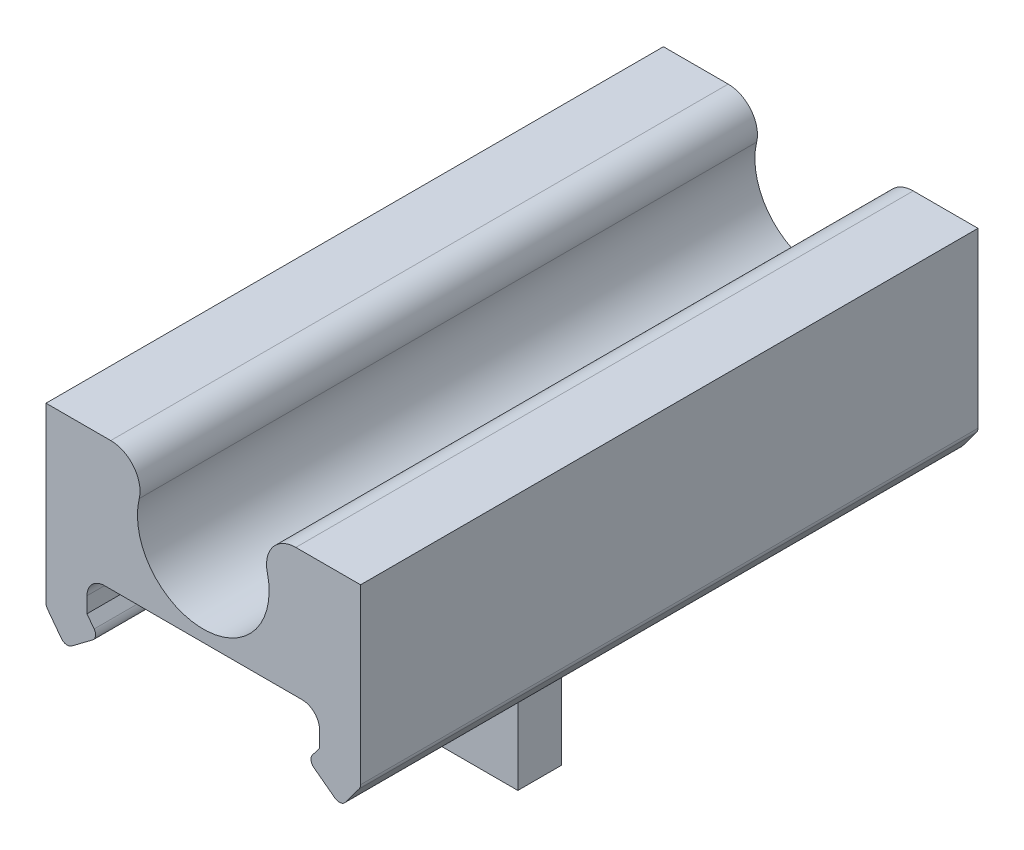
from build123d import *

# Parameters (mm, degrees)
EXTRUDE_1_DEPTH     = 42.2
CUT_EXTRUDE_5_DEPTH = 51.340143027
SKETCH_5_W          = 10
SKETCH_5_H          = 3
EXTRUDE_4_DEPTH     = 14.5
SKETCH_6_W          = 21.5
SKETCH_6_H          = 42.2
EXTRUDE_5_DEPTH     = 7
SKETCH_7_R          = 4.5
CUT_EXTRUDE_3_DEPTH = 42.2
FILLET_2_R          = 2
FILLET_3_R          = 0.5


with BuildPart() as part:
    # 草图2 → 凸台-拉伸1 (new body)
    with BuildSketch(Plane.XY):
        with BuildLine():
            ThreePointArc((2.5, 19.3), (2.207106781, 20.007106781), (1.5, 20.3))
            Line((1.5, 20.3), (-12, 20.3))
            ThreePointArc((-12, 20.3), (-12.707106781, 20.007106781), (-13, 19.3))
            Line((-13, 19.3), (-13, 18.3))
            Line((-13, 18.3), (-12.25, 17.3))
            Line((-12.25, 17.3), (-14.65, 15.5))
            Line((-14.65, 15.5), (-16, 17.3))
            Line((-16, 17.3), (-16, 22.3))
            Line((-16, 22.3), (5.5, 22.3))
            Line((5.5, 22.3), (5.5, 17.3))
            Line((5.5, 17.3), (4.15, 15.5))
            Line((4.15, 15.5), (1.75, 17.3))
            Line((1.75, 17.3), (2.5, 18.3))
            Line((2.5, 18.3), (2.5, 19.3))
        make_face()
    extrude(amount=-EXTRUDE_1_DEPTH)

    # 草图9 → 切除-拉伸5 (cut, through all)
    with BuildSketch(Plane(origin=(0, 0, -42.2), x_dir=(-1, 0, 0), z_dir=(0, 0, -1))):
        with BuildLine():
            Line((-2.7, 18.233333333), (-1.91, 17.18))
            Line((-1.91, 17.18), (-1.75, 17.3))
            Line((-1.75, 17.3), (-2.5, 18.3))
            Line((-2.5, 18.3), (-2.5, 19.3))
            ThreePointArc((-2.5, 19.3), (-2.207106781, 20.007106781), (-1.5, 20.3))
            Line((-1.5, 20.3), (12, 20.3))
            ThreePointArc((12, 20.3), (12.707106781, 20.007106781), (13, 19.3))
            Line((13, 19.3), (13, 18.3))
            Line((13, 18.3), (12.25, 17.3))
            Line((12.25, 17.3), (12.41, 17.18))
            Line((12.41, 17.18), (13.2, 18.233333333))
            Line((13.2, 18.233333333), (13.2, 19.3))
            ThreePointArc((13.2, 19.3), (12.848528137, 20.148528137), (12, 20.5))
            Line((12, 20.5), (-1.5, 20.5))
            ThreePointArc((-1.5, 20.5), (-2.348528137, 20.148528137), (-2.7, 19.3))
            Line((-2.7, 19.3), (-2.7, 18.233333333))
        make_face()
    extrude(amount=-CUT_EXTRUDE_5_DEPTH, mode=Mode.SUBTRACT)

    # 草图5 → 凸台-拉伸4 (add)
    with BuildSketch(Plane.XZ.offset(-20.5)):
        with Locations((-5.25, -18)):
            Rectangle(SKETCH_5_W, SKETCH_5_H)
    extrude(amount=EXTRUDE_4_DEPTH)

    # 草图6 → 凸台-拉伸5 (add)
    with BuildSketch(Plane(origin=(0, 22.3, 0), x_dir=(1, 0, 0), z_dir=(0, 1, 0))):
        with Locations((-5.25, 21.1)):
            Rectangle(SKETCH_6_W, SKETCH_6_H)
    extrude(amount=EXTRUDE_5_DEPTH)

    # 草图7 → 切除-拉伸3 (cut)
    with BuildSketch(Plane.XY):
        with Locations((-5.25, 25.8)):
            Circle(SKETCH_7_R)
    extrude(amount=-CUT_EXTRUDE_3_DEPTH, mode=Mode.SUBTRACT)

    # 圆角2
    fillet_2_edges = [part.edges().sort_by_distance(p)[0] for p in [
        (-2.421572875, 29.3, -21.1),
        (-8.078427125, 29.3, -21.1),
    ]]
    fillet(fillet_2_edges, radius=FILLET_2_R)

    # 圆角3
    fillet_3_edges = [part.edges().sort_by_distance(p)[0] for p in [
        (4.15, 15.5, -21.1),
        (5.5, 17.3, -21.1),
        (-16, 17.3, -21.1),
        (-14.65, 15.5, -21.1),
        (-12.41, 17.18, -21.1),
        (1.91, 17.18, -21.1),
    ]]
    fillet(fillet_3_edges, radius=FILLET_3_R)


solid = part.part
